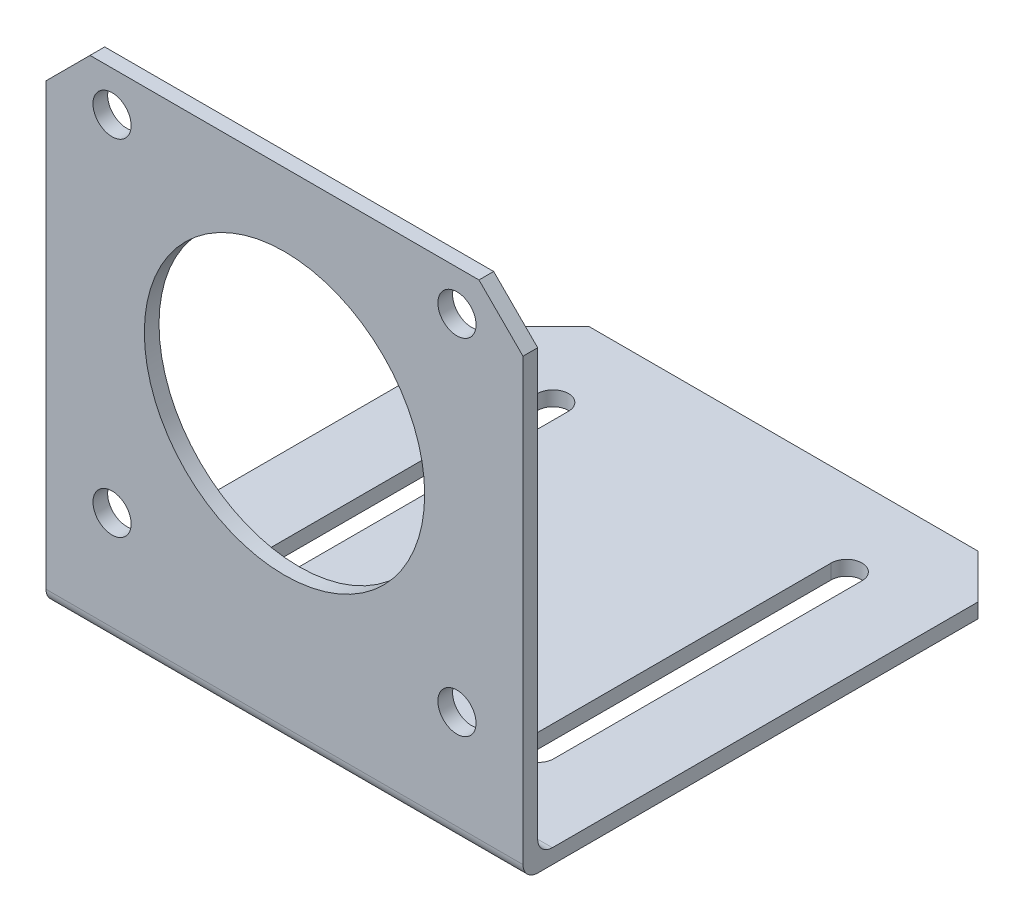
from build123d import *

# Parameters (mm, degrees)
SKETCH_1_W          = 65
SKETCH_1_H          = 68
SKETCH_1_R          = 19.1
EXTRUDE_1_DEPTH     = 2
SKETCH_3_W          = 66
SKETCH_3_H          = 2
EXTRUDE_2_DEPTH     = 65
CUT_EXTRUDE_2_DEPTH = 101.056869815
CHAMFER_2_SIZE      = 6
CHAMFER_3_SIZE      = 6
CHAMFER_4_SIZE      = 6
CHAMFER_5_SIZE      = 6
FILLET_1_R          = 2
FILLET_2_R          = 2
SKETCH_5_R          = 2.6
CUT_EXTRUDE_3_DEPTH = 91.629366018


with BuildPart() as part:
    # 草图1 → 凸台-拉伸1 (new body)
    with BuildSketch(Plane.XY):
        with Locations((3.546875, 16.5796875)):
            Rectangle(SKETCH_1_W, SKETCH_1_H)
        with Locations((3.546875, 21.5796875)):
            Circle(SKETCH_1_R, mode=Mode.SUBTRACT)
    extrude(amount=EXTRUDE_1_DEPTH)

    # 草图3 → 凸台-拉伸2 (add)
    with BuildSketch(Plane(origin=(36.046875, 0, 0), x_dir=(0, 0, -1), z_dir=(1, 0, 0))):
        with Locations((33, -16.4203125)):
            Rectangle(SKETCH_3_W, SKETCH_3_H)
    extrude(amount=-EXTRUDE_2_DEPTH)

    # 草图4 → 切除-拉伸2 (cut, through all)
    with BuildSketch(Plane(origin=(0, -15.4203125, 0), x_dir=(1, 0, 0), z_dir=(0, 1, 0))):
        with BuildLine():
            Line((21.446875, 12.59465164), (21.446875, 54.59465164))
            ThreePointArc((21.446875, 54.59465164), (23.546875, 56.69465164), (25.646875, 54.59465164))
            Line((25.646875, 54.59465164), (25.646875, 12.59465164))
            ThreePointArc((25.646875, 12.59465164), (23.546875, 10.49465164), (21.446875, 12.59465164))
        make_face()
        with BuildLine():
            Line((-14.353125, 12.59465164), (-14.353125, 54.59465164))
            ThreePointArc((-14.353125, 54.59465164), (-16.453125, 56.69465164), (-18.553125, 54.59465164))
            Line((-18.553125, 54.59465164), (-18.553125, 12.59465164))
            ThreePointArc((-18.553125, 12.59465164), (-16.453125, 10.49465164), (-14.353125, 12.59465164))
        make_face()
    extrude(amount=-CUT_EXTRUDE_2_DEPTH, mode=Mode.SUBTRACT)

    # 倒角2
    chamfer_2_edges = [part.edges().sort_by_distance(p)[0] for p in [
        (36.046875, -16.4203125, -66),
    ]]
    chamfer(chamfer_2_edges, length=CHAMFER_2_SIZE)

    # 倒角3
    chamfer_3_edges = [part.edges().sort_by_distance(p)[0] for p in [
        (-28.953125, -16.4203125, -66),
    ]]
    chamfer(chamfer_3_edges, length=CHAMFER_3_SIZE)

    # 倒角4
    chamfer_4_edges = [part.edges().sort_by_distance(p)[0] for p in [
        (-28.953125, 50.5796875, 1),
    ]]
    chamfer(chamfer_4_edges, length=CHAMFER_4_SIZE)

    # 倒角5
    chamfer_5_edges = [part.edges().sort_by_distance(p)[0] for p in [
        (36.046875, 50.5796875, 1),
    ]]
    chamfer(chamfer_5_edges, length=CHAMFER_5_SIZE)

    # 圆角1
    fillet_1_edges = [part.edges().sort_by_distance(p)[0] for p in [
        (3.546875, -17.4203125, 2),
    ]]
    fillet(fillet_1_edges, radius=FILLET_1_R)

    # 圆角2
    fillet_2_edges = [part.edges().sort_by_distance(p)[0] for p in [
        (3.546875, -15.4203125, 0),
    ]]
    fillet(fillet_2_edges, radius=FILLET_2_R)

    # 草图5 → 切除-拉伸3 (cut, through all)
    with BuildSketch(Plane(origin=(0, 0, 0), x_dir=(-1, 0, 0), z_dir=(0, 0, -1))):
        with Locations((-27.046875, 45.0796875)):
            Circle(SKETCH_5_R)
        with Locations(Location((19.953125, 45.0796875, 0), (0, 0, 180))):
            Circle(SKETCH_5_R)
        with Locations((19.953125, -1.9203125)):
            Circle(SKETCH_5_R)
        with Locations(Location((-27.046875, -1.9203125, 0), (0, 0, 180))):
            Circle(SKETCH_5_R)
    extrude(amount=-CUT_EXTRUDE_3_DEPTH, mode=Mode.SUBTRACT)


solid = part.part
